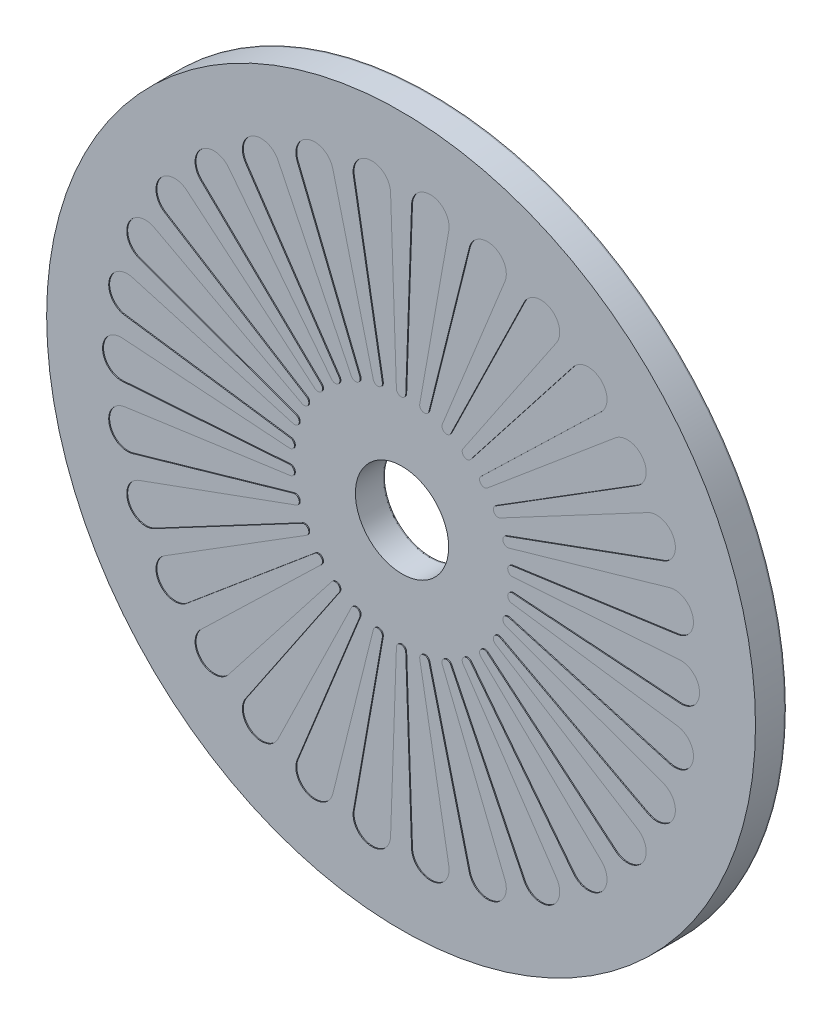
from build123d import *

# Parameters (mm, degrees)
SKETCH1_R           = 38
SKETCH1_R_2         = 5
BOSS_EXTRUDE1_DEPTH = 3
BOSS_EXTRUDE2_DEPTH = 0.1
CIRPATTERN1_COUNT   = 30
SKETCH3_R           = 38
SKETCH3_R_2         = 5
BOSS_EXTRUDE3_DEPTH = 0.1


with BuildPart() as part:
    # Sketch1 → Boss-Extrude1 (new body)
    with BuildSketch(Plane.XY):
        Circle(SKETCH1_R)
        Circle(SKETCH1_R_2, mode=Mode.SUBTRACT)
    extrude(amount=BOSS_EXTRUDE1_DEPTH)

    # Sketch2 → Boss-Extrude2 (add)
    with BuildSketch(Plane.XY.offset(3)):
        with BuildLine():
            Line((-1.125619028, 29.906657413), (-0.499695414, 11.982550252))
            ThreePointArc((-0.499695414, 11.982550252), (0, 11.5), (0.499695414, 11.982550252))
            Line((0.499695414, 11.982550252), (1.125619028, 29.906657413))
            ThreePointArc((1.125619028, 29.906657413), (1.811992939, 31.346025712), (3.332694061, 31.825982315))
            ThreePointArc((3.332694061, 31.825982315), (4.447457017, 31.689432404), (5.556741685, 31.513848096))
            Line((5.556741685, 31.513848096), (6.598630751, 37.422694614))
            ThreePointArc((6.598630751, 37.422694614), (4.012459952, 37.787566277), (1.407334418, 37.973930661))
            ThreePointArc((1.407334418, 37.973930661), (0, 38), (-1.407334418, 37.973930661))
            ThreePointArc((-1.407334418, 37.973930661), (-4.012459952, 37.787566277), (-6.598630751, 37.422694614))
            Line((-6.598630751, 37.422694614), (-5.556741685, 31.513848096))
            ThreePointArc((-5.556741685, 31.513848096), (-4.447457017, 31.689432404), (-3.332694061, 31.825982315))
            ThreePointArc((-3.332694061, 31.825982315), (-1.811992939, 31.346025712), (-1.125619028, 29.906657413))
        make_face()
    boss_extrude2 = extrude(amount=BOSS_EXTRUDE2_DEPTH)

    # CirPattern1: Boss-Extrude2 ×30 about axis
    cirpattern1_axis = Axis((0, 0, 0), (0, 0, 1))
    for i in range(1, CIRPATTERN1_COUNT):
        add(boss_extrude2.rotate(cirpattern1_axis, i * 360 / CIRPATTERN1_COUNT))


with BuildPart() as body_2:
    # Sketch3 → Boss-Extrude3 (new body)
    with BuildSketch(Plane(origin=(0, 0, 0), x_dir=(-1, 0, 0), z_dir=(0, 0, -1))):
        Circle(SKETCH3_R)
        Circle(SKETCH3_R_2, mode=Mode.SUBTRACT)
    extrude(amount=BOSS_EXTRUDE3_DEPTH)


solid = Compound([part.part, body_2.part])
